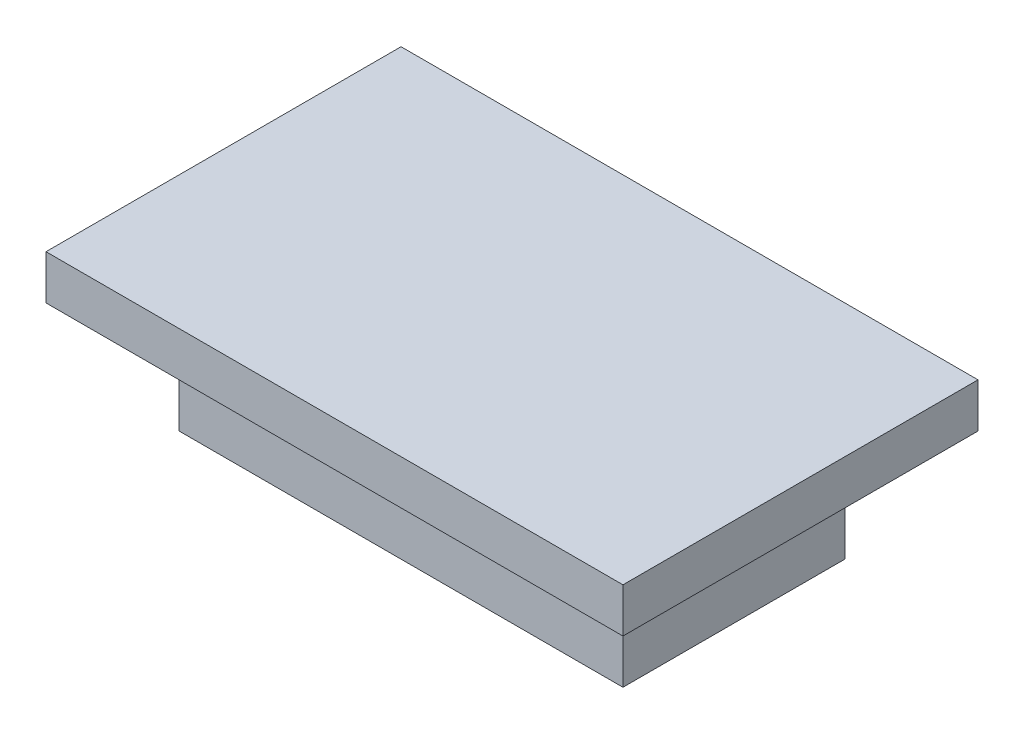
from build123d import *

# Parameters (mm, degrees)
SKETCH1_W           = 20
SKETCH1_H           = 10
BOSS_EXTRUDE1_DEPTH = 5
BOSS_EXTRUDE2_DEPTH = 2


with BuildPart() as part:
    # Sketch1 → Boss-Extrude1 (new body)
    with BuildSketch(Plane(origin=(0, 0, 0), x_dir=(1, 0, 0), z_dir=(0, 1, 0))):
        with Locations((10, 5)):
            Rectangle(SKETCH1_W, SKETCH1_H)
    extrude(amount=BOSS_EXTRUDE1_DEPTH)

    # Sketch2 → Boss-Extrude2 (add)
    with BuildSketch(Plane(origin=(0, 5, 0), x_dir=(1, 0, 0), z_dir=(0, 1, 0))):
        Polygon((-3, 13), (-3, 10), (-3, -3), (23, -3), (23, 13), align=None)
    extrude(amount=BOSS_EXTRUDE2_DEPTH)


solid = part.part
